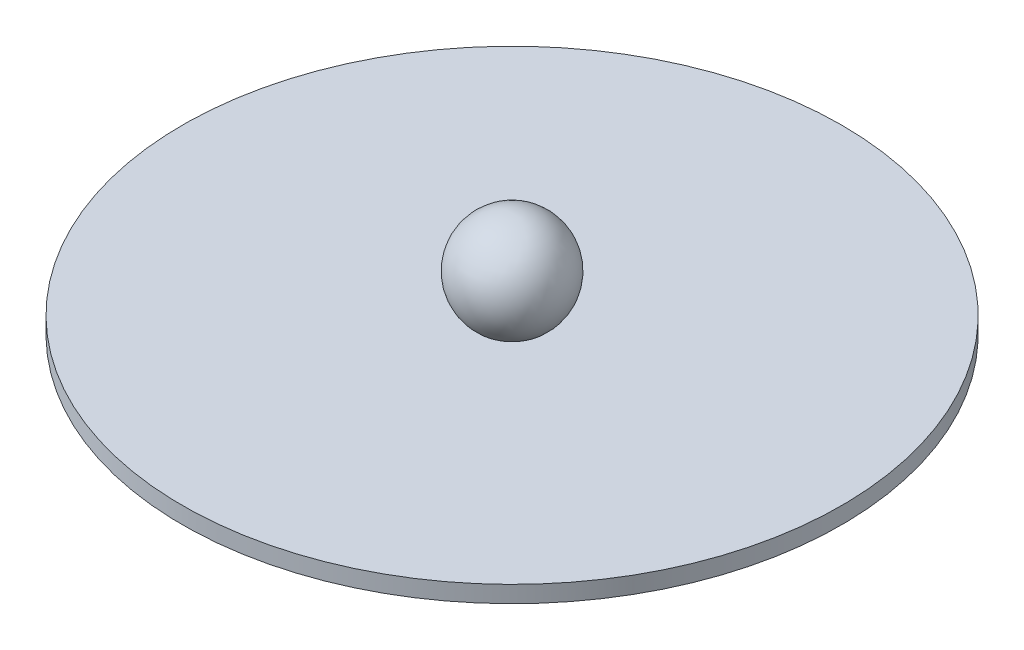
from build123d import *


with BuildPart() as part:
    # Sketch1 → Revolve1 (revolve)
    with BuildSketch(Plane.XY, mode=Mode.PRIVATE) as revolve1_sk:
        Polygon((125.095, 12.7), (125.095, 6.35), (120.015, 6.35), (113.665, 0), (0, 0), (0, 12.7), align=None)
    revolve(revolve1_sk.sketch.rotate(Axis((0, 0, 0), (0, 1, 0)), 90), axis=Axis((0, 0, 0), (0, 1, 0)))

    # Sketch2 → Revolve2 (revolve)
    with BuildSketch(Plane.XY):
        with BuildLine():
            Line((0, 46.314295443), (0, 8.214295443))
            ThreePointArc((0, 8.214295443), (19.05, 27.264295443), (0, 46.314295443))
        make_face()
    revolve(axis=Axis((0, 0, 0), (0, 1, 0)))


solid = part.part
